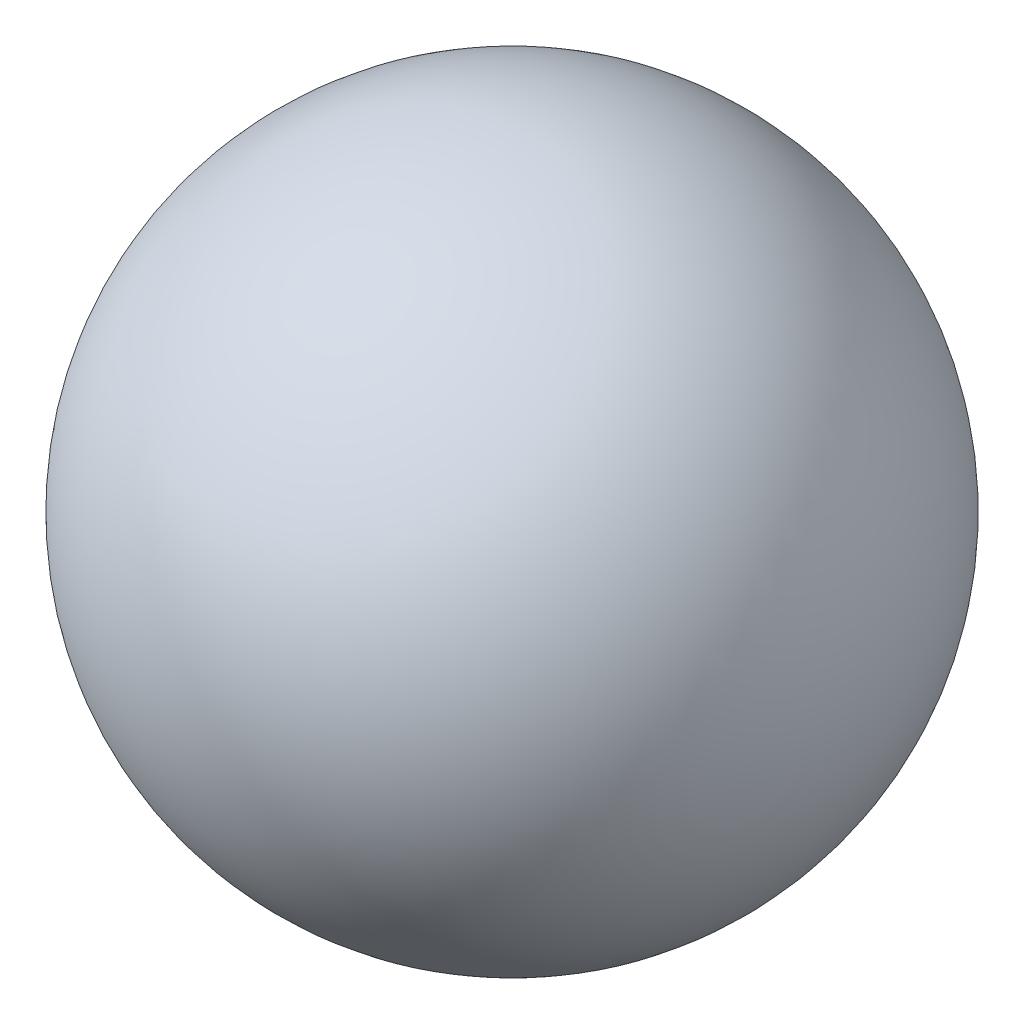
from build123d import *


with BuildPart() as part:
    # 草图1 → 旋转1 (revolve)
    with BuildSketch(Plane.XY):
        with BuildLine():
            Line((0, 95), (0, -95))
            ThreePointArc((0, -95), (95, 0), (0, 95))
        make_face()
    revolve(axis=Axis((0, 95, 0), (0, -1, 0)))


solid = part.part
